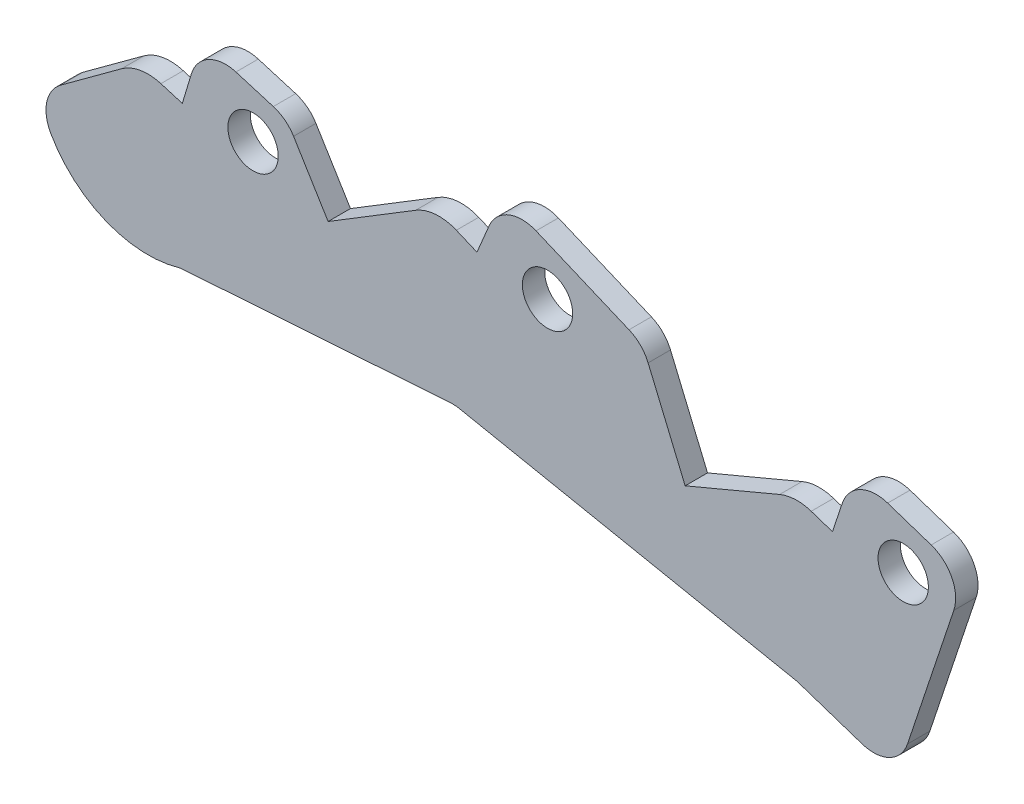
from build123d import *

# Parameters (mm, degrees)
SKETCH5_R           = 1.7859375
BOSS_EXTRUDE1_DEPTH = 1.5875
FILLET1_R           = 2.54


with BuildPart() as part:
    # Sketch5 → Boss-Extrude1 (new body)
    with BuildSketch(Plane.XY):
        with BuildLine():
            Line((89.745378764, 78.784933687), (88.224829537, 79.241098456))
            ThreePointArc((88.224829537, 79.241098456), (86.773324607, 79.32888397), (85.434920368, 78.760335862))
            Line((85.434920368, 78.760335862), (79.568453922, 74.458260468))
            ThreePointArc((79.568453922, 74.458260468), (83.306311174, 69.347675041), (89.593323842, 68.597253861))
            Line((89.593323842, 68.597253861), (109.072532015, 69.929775894))
            Line((109.072532015, 69.929775894), (133.35, 65.0875))
            Line((133.35, 65.0875), (140.381467098, 62.743677634))
            Line((140.381467098, 62.743677634), (145.272774991, 77.417601312))
            Line((145.272774991, 77.417601312), (137.366092628, 80.0531621))
            Line((137.366092628, 80.0531621), (135.860057893, 75.535057893))
            Line((135.860057893, 75.535057893), (134.354023157, 76.037069471))
            ThreePointArc((134.354023157, 76.037069471), (133.228154551, 76.197661136), (132.117919025, 75.951192316))
            Line((132.117919025, 75.951192316), (125.413170132, 73.128140151))
            Line((125.413170132, 73.128140151), (122.383992203, 80.322437731))
            Line((122.383992203, 80.322437731), (112.493298596, 84.486940303))
            Line((112.493298596, 84.486940303), (110.645177133, 80.097651828))
            Line((110.645177133, 80.097651828), (109.182080975, 80.713692316))
            ThreePointArc((109.182080975, 80.713692316), (107.712055506, 80.953571291), (106.29439622, 80.496669822))
            Line((106.29439622, 80.496669822), (100.08690833, 76.703205))
            Line((100.08690833, 76.703205), (97.130029166, 81.541734542))
            Line((97.130029166, 81.541734542), (91.113873069, 83.346581371))
            Line((91.113873069, 83.346581371), (89.745378764, 78.784933687))
        make_face()
        with Locations((140.880173678, 75.535057893)):
            Circle(SKETCH5_R, mode=Mode.SUBTRACT)
        with Locations((115.650506095, 79.712626524)):
            Circle(SKETCH5_R, mode=Mode.SUBTRACT)
        with Locations((94.763191216, 78.93698861)):
            Circle(SKETCH5_R, mode=Mode.SUBTRACT)
    extrude(amount=BOSS_EXTRUDE1_DEPTH)

    # Fillet1
    fillet1_edges = [part.edges().sort_by_distance(p)[0] for p in [
        (109.072532015, 69.929775894, 0.79375),
        (79.568453922, 74.458260468, 0.79375),
        (91.113873069, 83.346581371, 0.79375),
        (97.130029166, 81.541734542, 0.79375),
        (112.493298596, 84.486940303, 0.79375),
        (122.383992203, 80.322437731, 0.79375),
        (137.366092628, 80.0531621, 0.79375),
        (145.272774991, 77.417601312, 0.79375),
        (140.381467098, 62.743677634, 0.79375),
        (133.35, 65.0875, 0.79375),
    ]]
    fillet(fillet1_edges, radius=FILLET1_R)


solid = part.part
